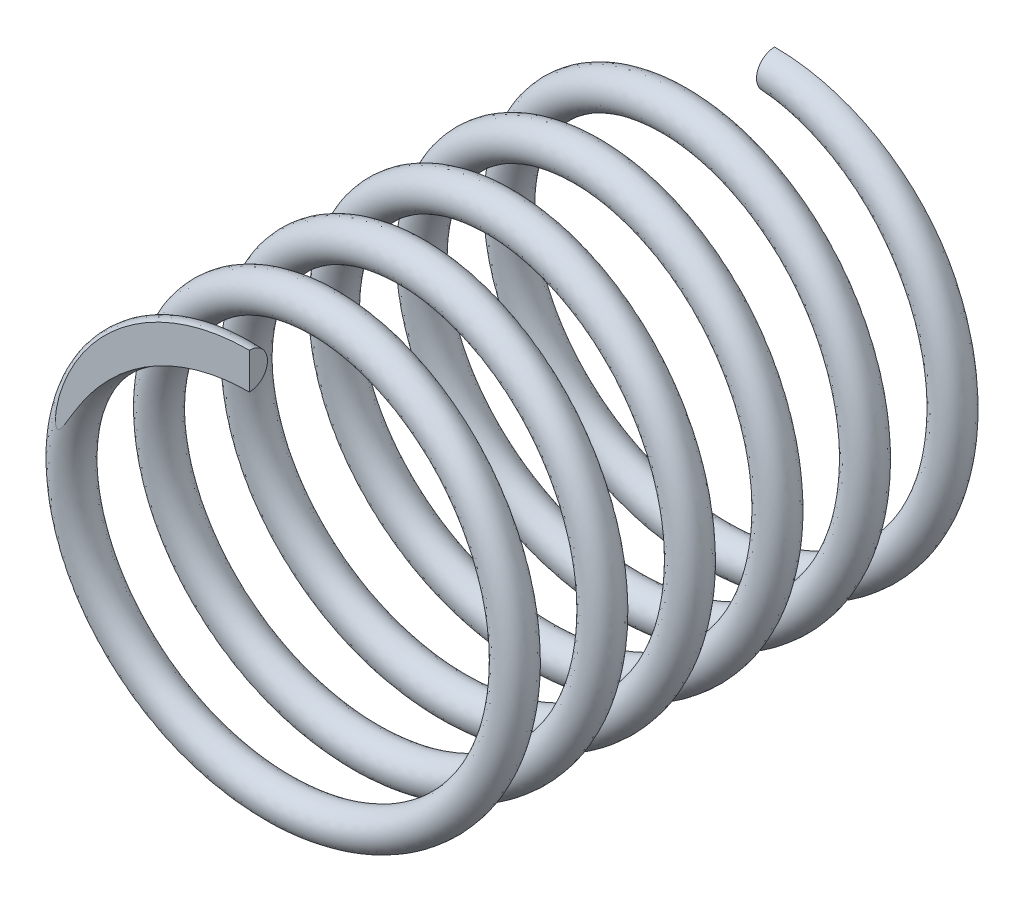
from build123d import *

# Parameters (mm, degrees)
BALAYAGE1_PITCH         = 2.416666667
BALAYAGE1_HEIGHT        = 14.5
BALAYAGE1_RADIUS        = 5.5
BALAYAGE1_START_ANGLE   = 90
ESQUISSE3_R             = 0.5
ESQUISSE4_W             = 2.379125605
ESQUISSE4_H             = 19.513404189
ENL_V_MAT_EXTRU_1_DEPTH = 18.233700643
ESQUISSE5_W             = 2.146641688
ESQUISSE5_H             = 18.739728202
ENL_V_MAT_EXTRU_2_DEPTH = 18.233700643


with BuildPart() as part:
    # Balayage1: sweep along a helix
    with BuildLine() as balayage1_path:
        add(Helix(BALAYAGE1_PITCH, BALAYAGE1_HEIGHT, BALAYAGE1_RADIUS, center=(0, 0, 0), direction=(0, 0, 1), lefthand=True, mode=Mode.PRIVATE).rotate(Axis((0, 0, 0), (0, 0, 1)), BALAYAGE1_START_ANGLE))
    # Esquisse3 → Balayage1 (sweep)
    with BuildSketch(Plane(origin=(0, 0, 0), x_dir=(0, 0, -1), z_dir=(1, 0, 0))):
        with Locations((0, 5.5)):
            Circle(ESQUISSE3_R)
    sweep(path=balayage1_path.line, is_frenet=True)

    # Esquisse4 → Enlèv. mat.-Extru.1 (cut, through all)
    with BuildSketch(Plane(origin=(0, 0, 0), x_dir=(0, 0, -1), z_dir=(1, 0, 0))):
        with Locations((-15.689562803, 0.266784824)):
            Rectangle(ESQUISSE4_W, ESQUISSE4_H)
    extrude(amount=-ENL_V_MAT_EXTRU_1_DEPTH, mode=Mode.SUBTRACT)

    # Esquisse5 → Enlèv. mat.-Extru.2 (cut, through all)
    with BuildSketch(Plane.ZY):
        with Locations((-1.073320844, 0.691734934)):
            Rectangle(ESQUISSE5_W, ESQUISSE5_H)
    extrude(amount=-ENL_V_MAT_EXTRU_2_DEPTH, mode=Mode.SUBTRACT)


solid = part.part
